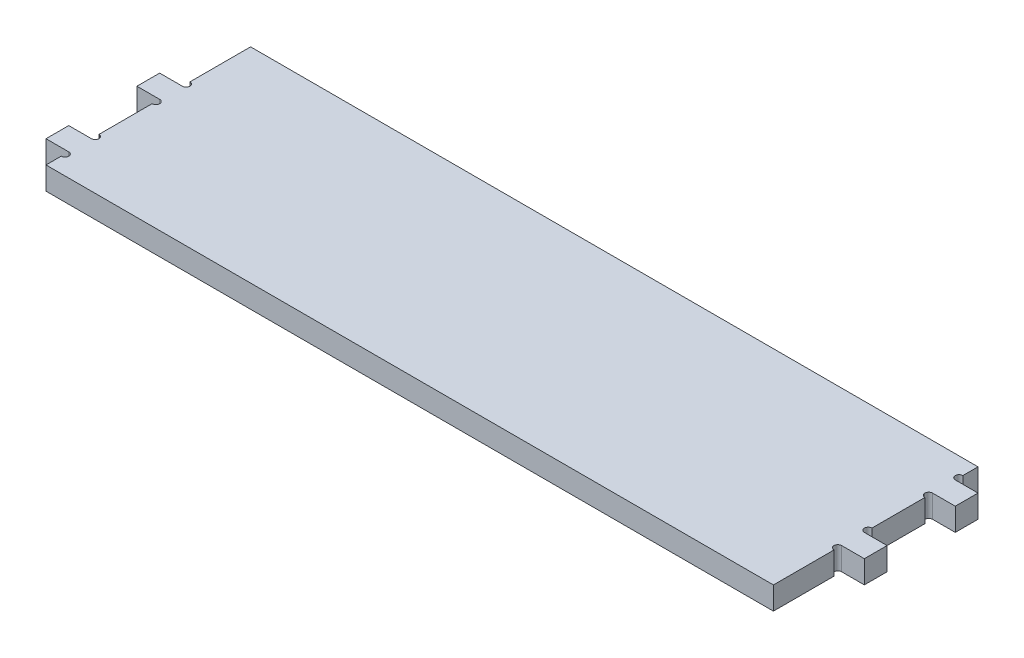
from build123d import *

# Parameters (mm, degrees)
SKETCH1_W               = 304.8
SKETCH1_H               = 171.45
BOSS_EXTRUDE1_DEPTH     = 19.05
SKETCH2_W               = 19.05
SKETCH2_H               = 19.05
BOSS_EXTRUDE2_DEPTH     = 19.05
SKETCH3_W               = 19.05
SKETCH3_H               = 19.05
CUT_EXTRUDE1_DEPTH      = 367.928913415
CUT_EXTRUDE2_DEPTH      = 367.928913415
CUT_EXTRUDE2_DEPTH_BACK = 367.928913415
CUT_EXTRUDE3_DEPTH      = 367.928913415
CUT_EXTRUDE3_DEPTH_BACK = 367.928913415
CUT_EXTRUDE4_DEPTH      = 367.928913415
SKETCH9_W               = 241.3
SKETCH9_H               = 171.45
BOSS_EXTRUDE3_DEPTH     = 19.05


with BuildPart() as part:
    # Sketch1 → Boss-Extrude1 (new body)
    with BuildSketch(Plane(origin=(0, 0, 0), x_dir=(1, 0, 0), z_dir=(0, 1, 0))):
        with Locations((-152.4, 85.725)):
            Rectangle(SKETCH1_W, SKETCH1_H)
    extrude(amount=BOSS_EXTRUDE1_DEPTH)

    # Mirror1: part across plane


with BuildPart() as part_1:
    add(part.part)
    add(part.part.mirror(Plane(origin=(0, 19.05, 0), x_dir=(0, 0, 1), z_dir=(-1, 0, 0))))

    # Sketch2 → Boss-Extrude2 (add)
    with BuildSketch(Plane(origin=(0, 19.05, 0), x_dir=(1, 0, 0), z_dir=(0, 1, 0))):
        with Locations((-314.325, 28.575)):
            Rectangle(SKETCH2_W, SKETCH2_H)
        with Locations((-314.325, 104.775)):
            Rectangle(SKETCH2_W, SKETCH2_H)
        with Locations((314.325, 142.875)):
            Rectangle(SKETCH2_W, SKETCH2_H)
        with Locations((314.325, 66.675)):
            Rectangle(SKETCH2_W, SKETCH2_H)
    extrude(amount=-BOSS_EXTRUDE2_DEPTH)

    # Sketch3 → Cut-Extrude1 (cut, symmetric)
    with BuildSketch(Plane(origin=(0, 19.05, 0), x_dir=(1, 0, 0), z_dir=(0, 1, 0))):
        with Locations((-104.775, 9.525)):
            Rectangle(SKETCH3_W, SKETCH3_H)
        with Locations((-104.775, 161.925)):
            Rectangle(SKETCH3_W, SKETCH3_H)
    cut_extrude1 = extrude(amount=CUT_EXTRUDE1_DEPTH, both=True, mode=Mode.SUBTRACT)

    # Mirror2: Cut-Extrude1 across plane
    add(cut_extrude1.mirror(Plane(origin=(0, 0, 0), x_dir=(0, 0, 1), z_dir=(1, 0, 0))), mode=Mode.SUBTRACT)

    # Sketch5 → Cut-Extrude2 (cut, two sides: drawn at the far end of the back side and taken through both)
    with BuildSketch(Plane(origin=(0, 19.05, 0), x_dir=(1, 0, 0), z_dir=(0, 1, 0)).offset(-CUT_EXTRUDE2_DEPTH_BACK)):
        with BuildLine():
            Line((9.525, 131.490128061), (9.525, 141.559871939))
            ThreePointArc((9.525, 141.559871939), (9.525, 146.05), (5.034871939, 146.05))
            Line((5.034871939, 146.05), (-5.034871939, 146.05))
            ThreePointArc((-5.034871939, 146.05), (-9.525, 146.05), (-9.525, 141.559871939))
            Line((-9.525, 141.559871939), (-9.525, 131.490128061))
            ThreePointArc((-9.525, 131.490128061), (-9.525, 127), (-5.034871939, 127))
            Line((-5.034871939, 127), (5.034871939, 127))
            ThreePointArc((5.034871939, 127), (9.525, 127), (9.525, 131.490128061))
        make_face()
        with BuildLine():
            Line((9.525, 80.690128061), (9.525, 90.759871939))
            ThreePointArc((9.525, 90.759871939), (9.525, 95.25), (5.034871939, 95.25))
            Line((5.034871939, 95.25), (-5.034871939, 95.25))
            ThreePointArc((-5.034871939, 95.25), (-9.525, 95.25), (-9.525, 90.759871939))
            Line((-9.525, 90.759871939), (-9.525, 80.690128061))
            ThreePointArc((-9.525, 80.690128061), (-9.525, 76.2), (-5.034871939, 76.2))
            Line((-5.034871939, 76.2), (5.034871939, 76.2))
            ThreePointArc((5.034871939, 76.2), (9.525, 76.2), (9.525, 80.690128061))
        make_face()
        with BuildLine():
            Line((9.525, 29.890128061), (9.525, 39.959871939))
            ThreePointArc((9.525, 39.959871939), (9.525, 44.45), (5.034871939, 44.45))
            Line((5.034871939, 44.45), (-5.034871939, 44.45))
            ThreePointArc((-5.034871939, 44.45), (-9.525, 44.45), (-9.525, 39.959871939))
            Line((-9.525, 39.959871939), (-9.525, 29.890128061))
            ThreePointArc((-9.525, 29.890128061), (-9.525, 25.4), (-5.034871939, 25.4))
            Line((-5.034871939, 25.4), (5.034871939, 25.4))
            ThreePointArc((5.034871939, 25.4), (9.525, 25.4), (9.525, 29.890128061))
        make_face()
    extrude(amount=CUT_EXTRUDE2_DEPTH + CUT_EXTRUDE2_DEPTH_BACK, mode=Mode.SUBTRACT)

    # Sketch6 → Cut-Extrude3 (cut, two sides: drawn at the far end of the back side and taken through both)
    with BuildSketch(Plane(origin=(0, 19.05, 0), x_dir=(1, 0, 0), z_dir=(0, 1, 0)).offset(-CUT_EXTRUDE3_DEPTH_BACK)):
        with BuildLine():
            Line((-114.3, 166.959871939), (-114.3, 156.890128061))
            ThreePointArc((-114.3, 156.890128061), (-114.3, 152.4), (-109.809871939, 152.4))
            Line((-109.809871939, 152.4), (-99.740128061, 152.4))
            ThreePointArc((-99.740128061, 152.4), (-95.25, 152.4), (-95.25, 156.890128061))
            Line((-95.25, 156.890128061), (-95.25, 166.959871939))
            Line((-95.25, 166.959871939), (-114.3, 166.959871939))
        make_face()
        with BuildLine():
            ThreePointArc((114.3, 156.890128061), (114.3, 152.4), (109.809871939, 152.4))
            Line((109.809871939, 152.4), (99.740128061, 152.4))
            ThreePointArc((99.740128061, 152.4), (95.25, 152.4), (95.25, 156.890128061))
            Line((95.25, 156.890128061), (95.25, 166.959871939))
            Line((95.25, 166.959871939), (114.3, 166.959871939))
            Line((114.3, 166.959871939), (114.3, 156.890128061))
        make_face()
        with BuildLine():
            ThreePointArc((95.25, 14.559871939), (95.25, 19.05), (99.740128061, 19.05))
            Line((99.740128061, 19.05), (109.809871939, 19.05))
            ThreePointArc((109.809871939, 19.05), (114.3, 19.05), (114.3, 14.559871939))
            Line((114.3, 14.559871939), (114.3, 4.490128061))
            Line((114.3, 4.490128061), (95.25, 4.490128061))
            Line((95.25, 4.490128061), (95.25, 14.559871939))
        make_face()
        with BuildLine():
            Line((-95.25, 4.490128061), (-95.25, 14.559871939))
            ThreePointArc((-95.25, 14.559871939), (-95.25, 19.05), (-99.740128061, 19.05))
            Line((-99.740128061, 19.05), (-109.809871939, 19.05))
            ThreePointArc((-109.809871939, 19.05), (-114.3, 19.05), (-114.3, 14.559871939))
            Line((-114.3, 14.559871939), (-114.3, 4.490128061))
            Line((-114.3, 4.490128061), (-95.25, 4.490128061))
        make_face()
    extrude(amount=CUT_EXTRUDE3_DEPTH + CUT_EXTRUDE3_DEPTH_BACK, mode=Mode.SUBTRACT)

    # Sketch8 → Cut-Extrude4 (cut, through all)
    with BuildSketch(Plane(origin=(0, 19.05, 0), x_dir=(1, 0, 0), z_dir=(0, 1, 0))):
        with BuildLine():
            Line((-304.8, 120.65), (-304.8, 114.3))
            ThreePointArc((-304.8, 114.3), (-301.625, 117.475), (-304.8, 120.65))
        make_face()
        with BuildLine():
            Line((-304.8, 95.25), (-304.8, 88.9))
            ThreePointArc((-304.8, 88.9), (-301.625, 92.075), (-304.8, 95.25))
        make_face()
        with BuildLine():
            Line((-304.8, 44.45), (-304.8, 38.1))
            ThreePointArc((-304.8, 38.1), (-301.625, 41.275), (-304.8, 44.45))
        make_face()
        with BuildLine():
            Line((-304.8, 19.05), (-304.8, 12.7))
            ThreePointArc((-304.8, 12.7), (-301.625, 15.875), (-304.8, 19.05))
        make_face()
        with BuildLine():
            ThreePointArc((304.8, 158.75), (301.625, 155.575), (304.8, 152.4))
            Line((304.8, 152.4), (304.8, 158.75))
        make_face()
        with BuildLine():
            ThreePointArc((304.8, 133.35), (301.625, 130.175), (304.8, 127))
            Line((304.8, 127), (304.8, 133.35))
        make_face()
        with BuildLine():
            ThreePointArc((304.8, 57.15), (301.625, 53.975), (304.8, 50.8))
            Line((304.8, 50.8), (304.8, 57.15))
        make_face()
        with BuildLine():
            ThreePointArc((304.8, 82.55), (301.625, 79.375), (304.8, 76.2))
            Line((304.8, 76.2), (304.8, 82.55))
        make_face()
    extrude(amount=-CUT_EXTRUDE4_DEPTH, mode=Mode.SUBTRACT)

    # Sketch9 → Boss-Extrude3 (add)
    with BuildSketch(Plane(origin=(0, 19.05, 0), x_dir=(1, 0, 0), z_dir=(0, 1, 0))):
        with Locations((0, 85.725)):
            Rectangle(SKETCH9_W, SKETCH9_H)
    extrude(amount=-BOSS_EXTRUDE3_DEPTH)


solid = part_1.part
